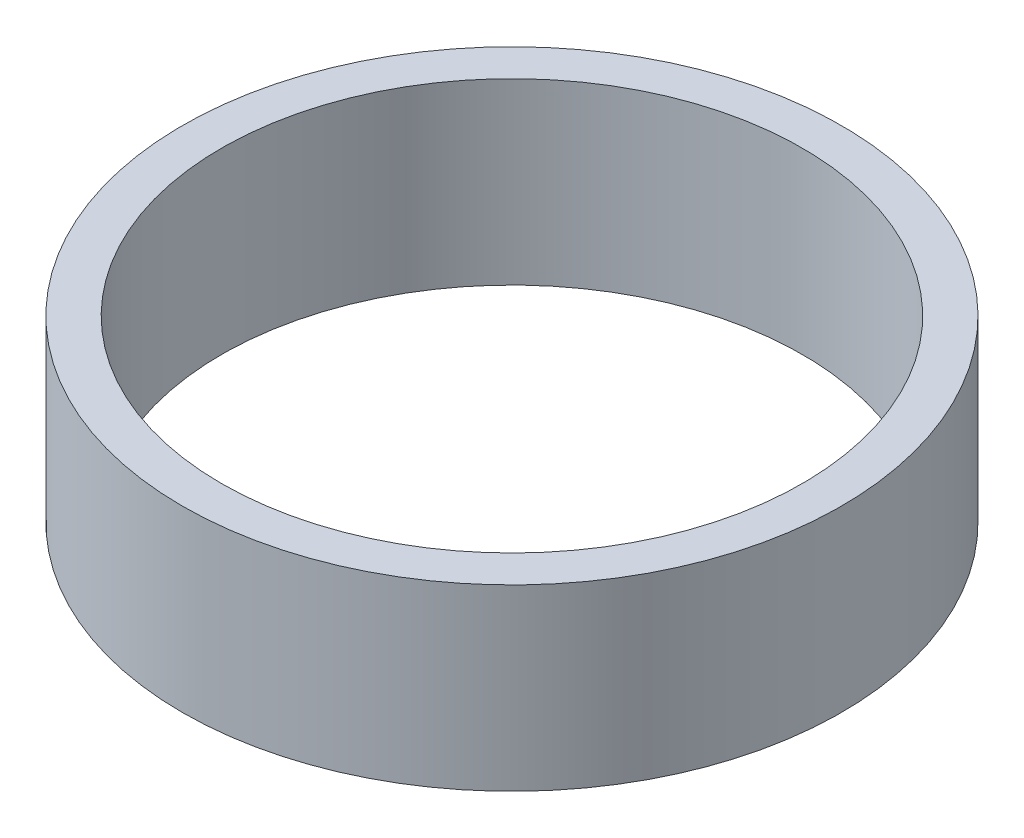
from build123d import *

# Parameters (mm, degrees)
SKETCH1_R           = 14.75
SKETCH1_R_2         = 13
BOSS_EXTRUDE1_DEPTH = 8


with BuildPart() as part:
    # Sketch1 → Boss-Extrude1 (new body)
    with BuildSketch(Plane(origin=(0, 0, 0), x_dir=(1, 0, 0), z_dir=(0, 1, 0))):
        with Locations(Location((0, 0, 0), (0, 0, 270))):
            Circle(SKETCH1_R)
        with Locations(Location((0, 0, 0), (0, 0, 270))):
            Circle(SKETCH1_R_2, mode=Mode.SUBTRACT)
    extrude(amount=BOSS_EXTRUDE1_DEPTH)


solid = part.part
